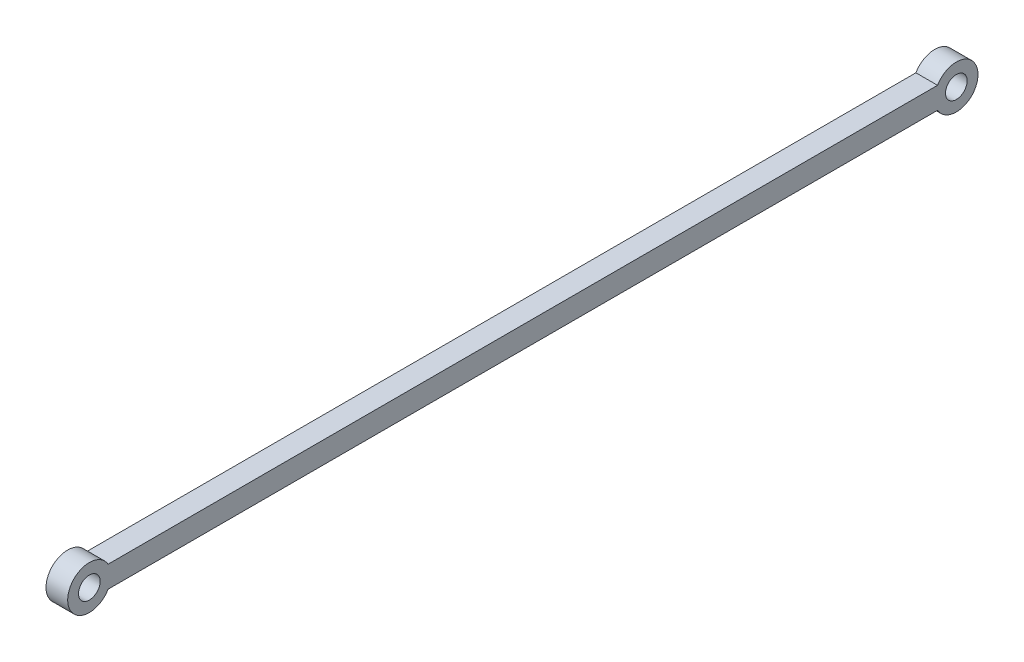
from build123d import *

# Parameters (mm, degrees)
SKETCH_1_R      = 1.25
EXTRUDE_1_DEPTH = 2.5


with BuildPart() as part:
    # 스케치1 → 보스-돌출1 (new body)
    with BuildSketch(Plane(origin=(0, 0, 0), x_dir=(0, 0, -1), z_dir=(1, 0, 0))):
        with BuildLine():
            Line((-47.834936491, 1.25), (47.834936491, 1.25))
            ThreePointArc((47.834936491, 1.25), (52.5, 0), (47.834936491, -1.25))
            Line((47.834936491, -1.25), (-47.834936491, -1.25))
            ThreePointArc((-47.834936491, -1.25), (-52.5, 0), (-47.834936491, 1.25))
        make_face()
        with Locations((-50, 0)):
            Circle(SKETCH_1_R, mode=Mode.SUBTRACT)
        with Locations((50, 0)):
            Circle(SKETCH_1_R, mode=Mode.SUBTRACT)
    extrude(amount=EXTRUDE_1_DEPTH)


solid = part.part
